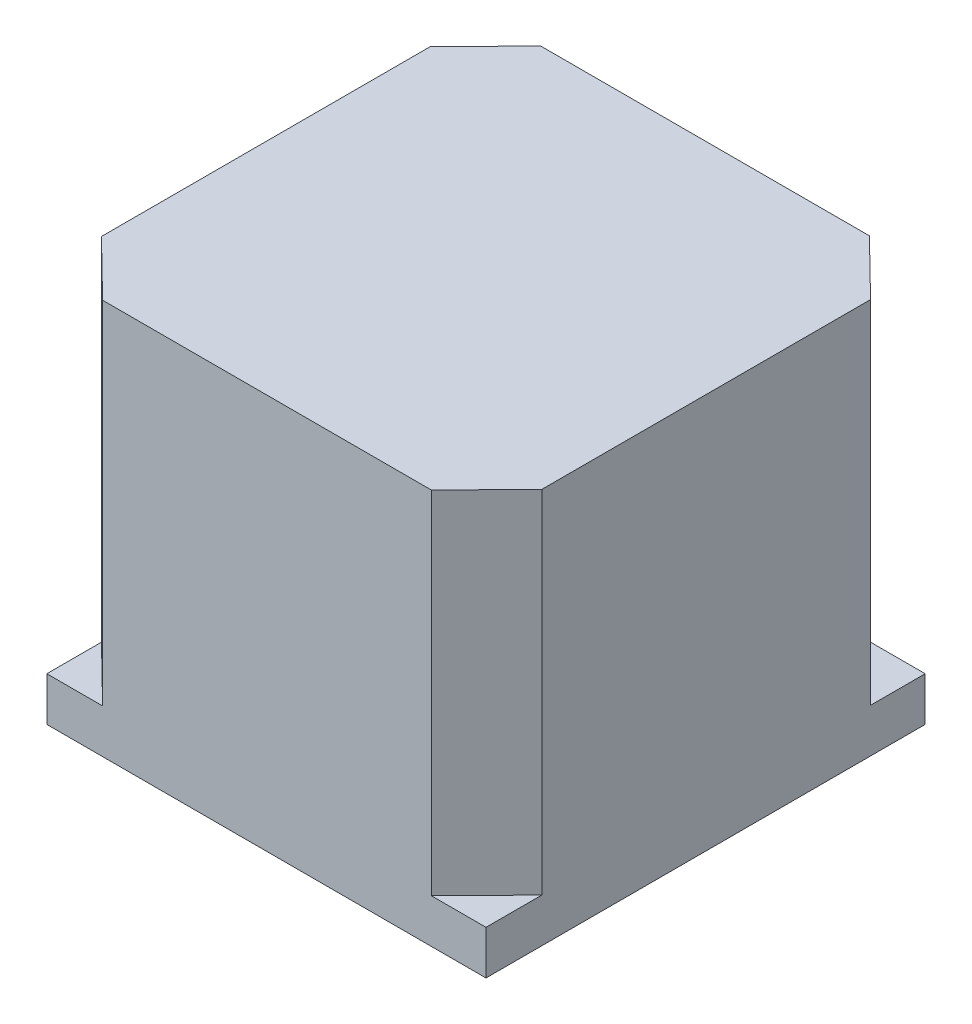
from build123d import *

# Parameters (mm, degrees)
SKETCH1_W           = 100
SKETCH1_H           = 100
BOSS_EXTRUDE1_DEPTH = 90
CUT_EXTRUDE1_DEPTH  = 80


with BuildPart() as part:
    # Sketch1 → Boss-Extrude1 (new body)
    with BuildSketch(Plane(origin=(0, 0, 0), x_dir=(1, 0, 0), z_dir=(0, 1, 0))):
        Rectangle(SKETCH1_W, SKETCH1_H)
    extrude(amount=BOSS_EXTRUDE1_DEPTH)

    # Sketch2 → Cut-Extrude1 (cut)
    with BuildSketch(Plane(origin=(0, 90, 0), x_dir=(1, 0, 0), z_dir=(0, 1, 0))):
        Polygon((-50, 50), (-50, 37.300043471), (-37.556734796, 50), align=None)
        Polygon((-37.300043471, -50), (-50, -37.556734796), (-50, -50), align=None)
        Polygon((50, -37.300043471), (37.556734796, -50), (50, -50), align=None)
        Polygon((50, 50), (37.300043471, 50), (50, 37.556734796), align=None)
    extrude(amount=-CUT_EXTRUDE1_DEPTH, mode=Mode.SUBTRACT)


solid = part.part
